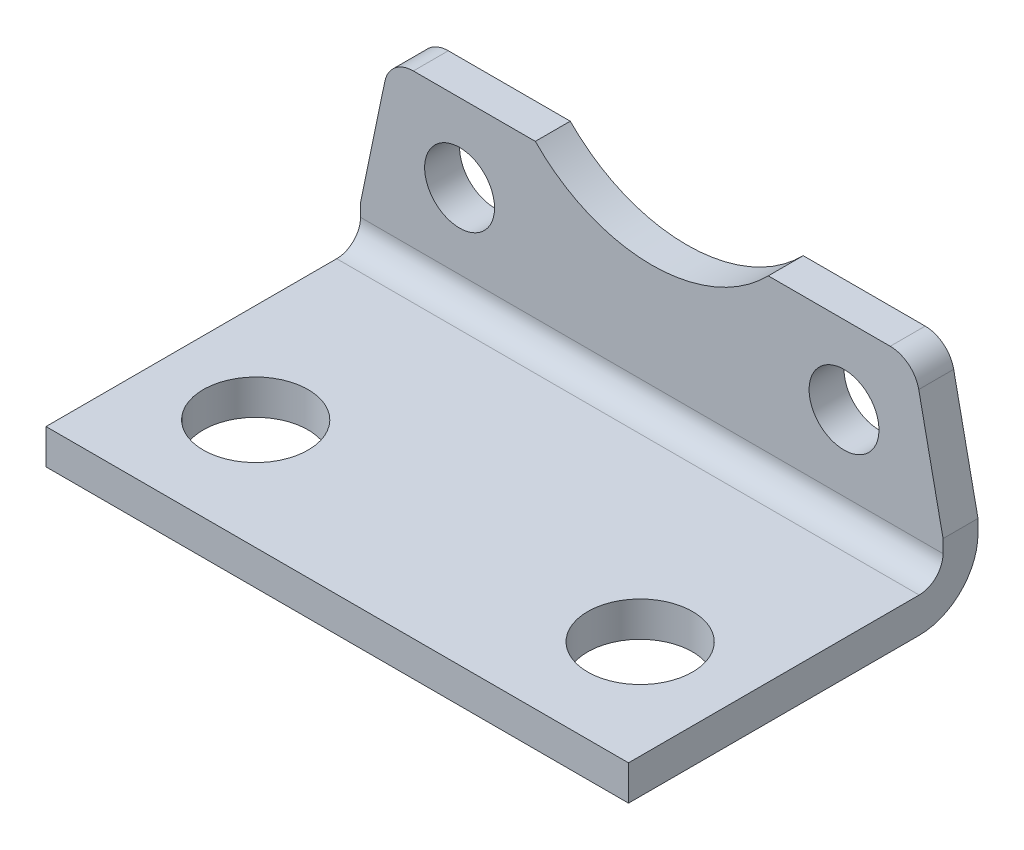
from build123d import *

# Parameters (mm, degrees)
EXTRUDE_START          = 25
EXTRUDE_1_DEPTH        = 50
SKETCH_4_R             = 4.5
CUT_EXTRUDE_1_DEPTH    = 85.274847968
SKETCH_6_R             = 3
CUT_EXTRUDE_2_DEPTH    = 47.238512087
SKETCH_7_R             = 14
CUT_EXTRUDE_3_DEPTH    = 47.238512087
SKETCH_9_W             = 50
SKETCH_9_H             = 9.8
CUT_EXTRUDE_4_DEPTH    = 47.238512087
CUT_EXTRUDE_1943_DEPTH = 42.051674753
FILLET_1_R             = 2.5


with BuildPart() as part:
    # 草图3 → 凸台-拉伸1 (new body)
    with BuildSketch(Plane(origin=(0, 0, 0), x_dir=(0, 0, -1), z_dir=(1, 0, 0)).offset(EXTRUDE_START)):
        with BuildLine():
            Line((-76.5, 0), (-76.5, 3))
            Line((-76.5, 3), (-51.55, 3))
            ThreePointArc((-51.55, 3), (-50.100431099, 3.600431099), (-49.5, 5.05))
            Line((-49.5, 5.05), (-49.5, 28))
            Line((-49.5, 28), (-46.5, 28))
            Line((-46.5, 28), (-46.5, 5.05))
            ThreePointArc((-46.5, 5.05), (-47.979110755, 1.479110755), (-51.55, 0))
            Line((-51.55, 0), (-76.5, 0))
        make_face()
    extrude(amount=-EXTRUDE_1_DEPTH)

    # 草图4 → 切除-拉伸1 (cut, through all)
    with BuildSketch(Plane(origin=(0, 3, 0), x_dir=(1, 0, 0), z_dir=(0, 1, 0))):
        with Locations(Location((-16.5, -67, 0), (0, 0, 270))):
            Circle(SKETCH_4_R)
    cut_extrude_1 = extrude(amount=-CUT_EXTRUDE_1_DEPTH, mode=Mode.SUBTRACT)

    # 镜向1: 切除-拉伸1 across plane
    add(cut_extrude_1.mirror(Plane(origin=(0, 0, 0), x_dir=(0, 0, 1), z_dir=(1, 0, 0))), mode=Mode.SUBTRACT)

    # 草图6 → 切除-拉伸2 (cut, through all)
    with BuildSketch(Plane.XY.offset(49.5)):
        with Locations((-16.5, 11.5)):
            Circle(SKETCH_6_R)
    cut_extrude_2 = extrude(amount=-CUT_EXTRUDE_2_DEPTH, mode=Mode.SUBTRACT)

    # 镜向2: 切除-拉伸2 across plane
    add(cut_extrude_2.mirror(Plane(origin=(0, 0, 0), x_dir=(0, 0, 1), z_dir=(1, 0, 0))), mode=Mode.SUBTRACT)

    # 草图7 → 切除-拉伸3 (cut, through all)
    with BuildSketch(Plane.XY.offset(49.5)):
        with Locations((0, 28)):
            Circle(SKETCH_7_R)
    extrude(amount=-CUT_EXTRUDE_3_DEPTH, mode=Mode.SUBTRACT)

    # 草图9 → 切除-拉伸4 (cut, through all)
    with BuildSketch(Plane.XY.offset(49.5)):
        with Locations((0, 23.1)):
            Rectangle(SKETCH_9_W, SKETCH_9_H)
    extrude(amount=-CUT_EXTRUDE_4_DEPTH, mode=Mode.SUBTRACT)

    # 草图8 → Cut-Extrude 1943 (cut, through all)
    with BuildSketch(Plane.XY.offset(49.5)):
        Polygon((-22.5, 18.2), (22.5, 18.2), (25, 6.17), (25, 28), (-25, 28), (-25, 6.17), align=None)
    extrude(amount=-CUT_EXTRUDE_1943_DEPTH, mode=Mode.SUBTRACT)

    # 圆角1
    fillet_1_edges = [part.edges().sort_by_distance(p)[0] for p in [
        (22.5, 18.2, 48),
        (-22.5, 18.2, 48),
    ]]
    fillet(fillet_1_edges, radius=FILLET_1_R)


solid = part.part
